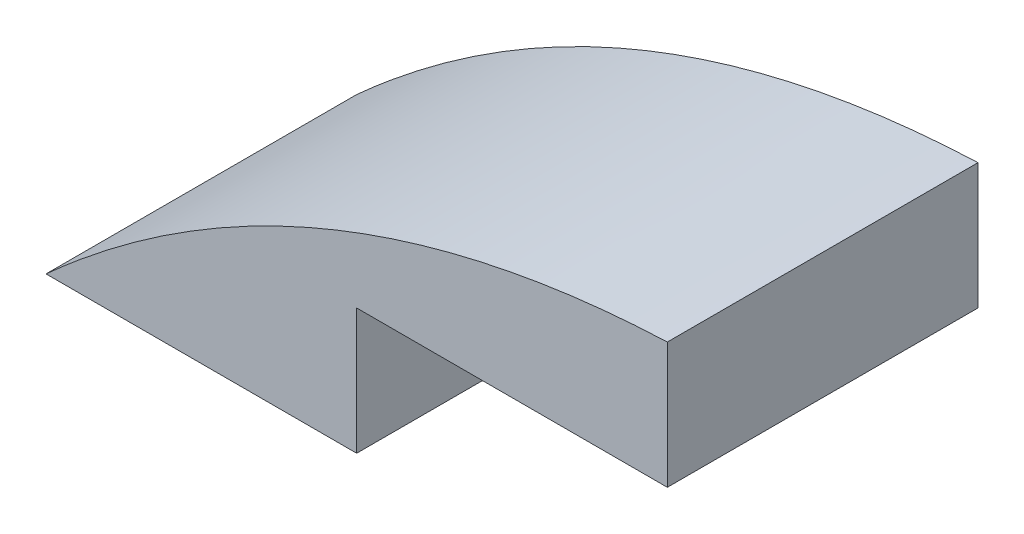
from build123d import *

# Parameters (mm, degrees)
SKETCH2_W           = 7.9
SKETCH2_H           = 7.9
BOSS_EXTRUDE1_DEPTH = 3.2
SKETCH3_W           = 7.9
SKETCH3_H           = 7.9
BOSS_EXTRUDE2_DEPTH = 3.2
SKETCH7_W           = 7.9
SKETCH7_H           = 3.2
BOSS_EXTRUDE5_DEPTH = 7.2
CUT_EXTRUDE2_DEPTH  = 8.2


with BuildPart() as part:
    # Sketch2 → Boss-Extrude1 (new body)
    with BuildSketch(Plane(origin=(0, 0, 0), x_dir=(1, 0, 0), z_dir=(0, 1, 0))):
        with Locations((3.95, 3.95)):
            Rectangle(SKETCH2_W, SKETCH2_H)
    extrude(amount=BOSS_EXTRUDE1_DEPTH)



with BuildPart() as body_2:
    # Sketch3 → Boss-Extrude2 (new body)
    with BuildSketch(Plane(origin=(0, 3.2, 0), x_dir=(1, 0, 0), z_dir=(0, 1, 0))):
        with Locations((11.85, 3.95)):
            Rectangle(SKETCH3_W, SKETCH3_H)
    extrude(amount=BOSS_EXTRUDE2_DEPTH)


with BuildPart() as part_1:
    add(part.part)

    add(body_2.part)  # Boss-Extrude5 merges body 2
    # Sketch7 → Boss-Extrude5 (add)
    with BuildSketch(Plane.ZY.offset(-7.9)):
        with Locations((-3.95, 4.8)):
            Rectangle(SKETCH7_W, SKETCH7_H)
    extrude(amount=BOSS_EXTRUDE5_DEPTH)

    # Sketch4 → Cut-Extrude2 (cut)
    with BuildSketch(Plane(origin=(0, 0, -7.9), x_dir=(-1, 0, 0), z_dir=(0, 0, -1))):
        with BuildLine():
            Line((-15.8, 6.4), (0, 6.4))
            Line((0, 6.4), (0, 0))
            add(Edge.make_bspline(
                [(-15.8, 6.4), (-6.684647753, 6.042665729), (0, 0)],
                knots=[0, 0, 0, 1, 1, 1], degree=2))
        make_face()
    extrude(amount=-CUT_EXTRUDE2_DEPTH, mode=Mode.SUBTRACT)


solid = part_1.part
